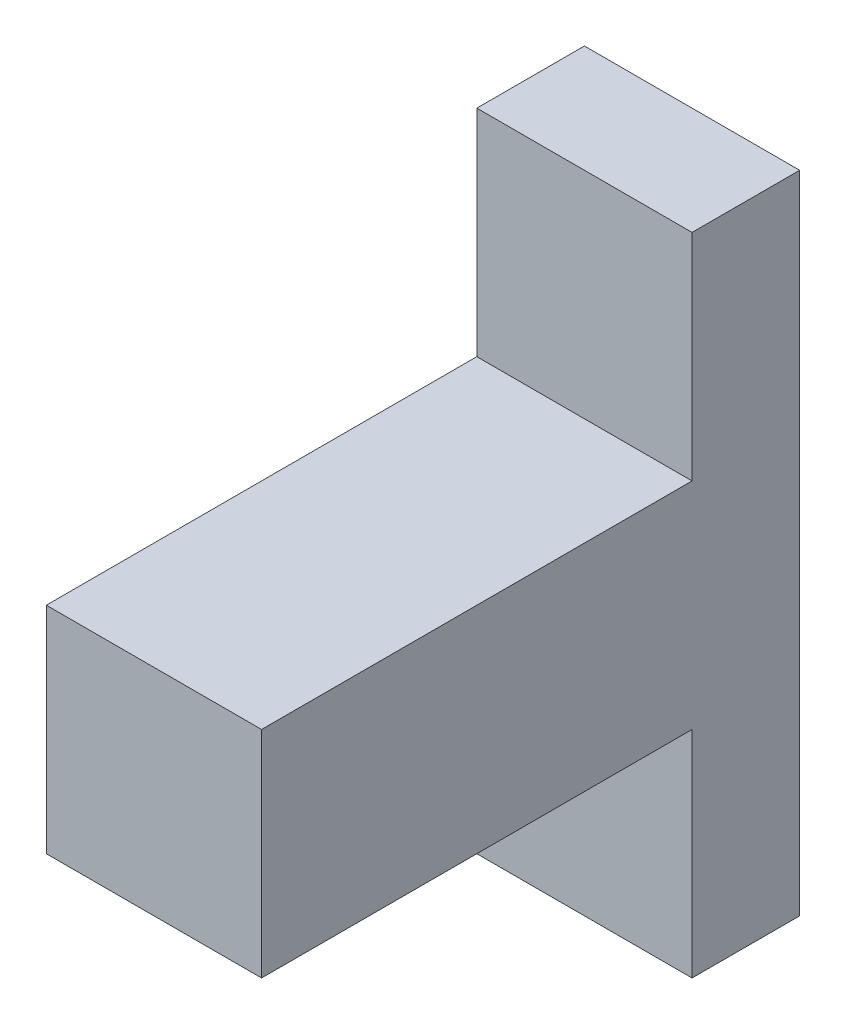
from build123d import *

# Parameters (mm, degrees)
SKETCH1_W           = 20
SKETCH1_H           = 20
BOSS_EXTRUDE1_DEPTH = 50
SKETCH3_W           = 20
SKETCH3_H           = 10
BOSS_EXTRUDE3_DEPTH = 20


with BuildPart() as part:
    # Sketch1 → Boss-Extrude1 (new body)
    with BuildSketch(Plane.XY):
        Rectangle(SKETCH1_W, SKETCH1_H)
    extrude(amount=BOSS_EXTRUDE1_DEPTH)

    # Sketch3 → Boss-Extrude3 (add)
    with BuildSketch(Plane(origin=(0, 10, 0), x_dir=(1, 0, 0), z_dir=(0, 1, 0))):
        with Locations((0, -5)):
            Rectangle(SKETCH3_W, SKETCH3_H)
    boss_extrude3 = extrude(amount=BOSS_EXTRUDE3_DEPTH)

    # Mirror2: Boss-Extrude3 across plane
    add(boss_extrude3.mirror(Plane.ZX))


solid = part.part
